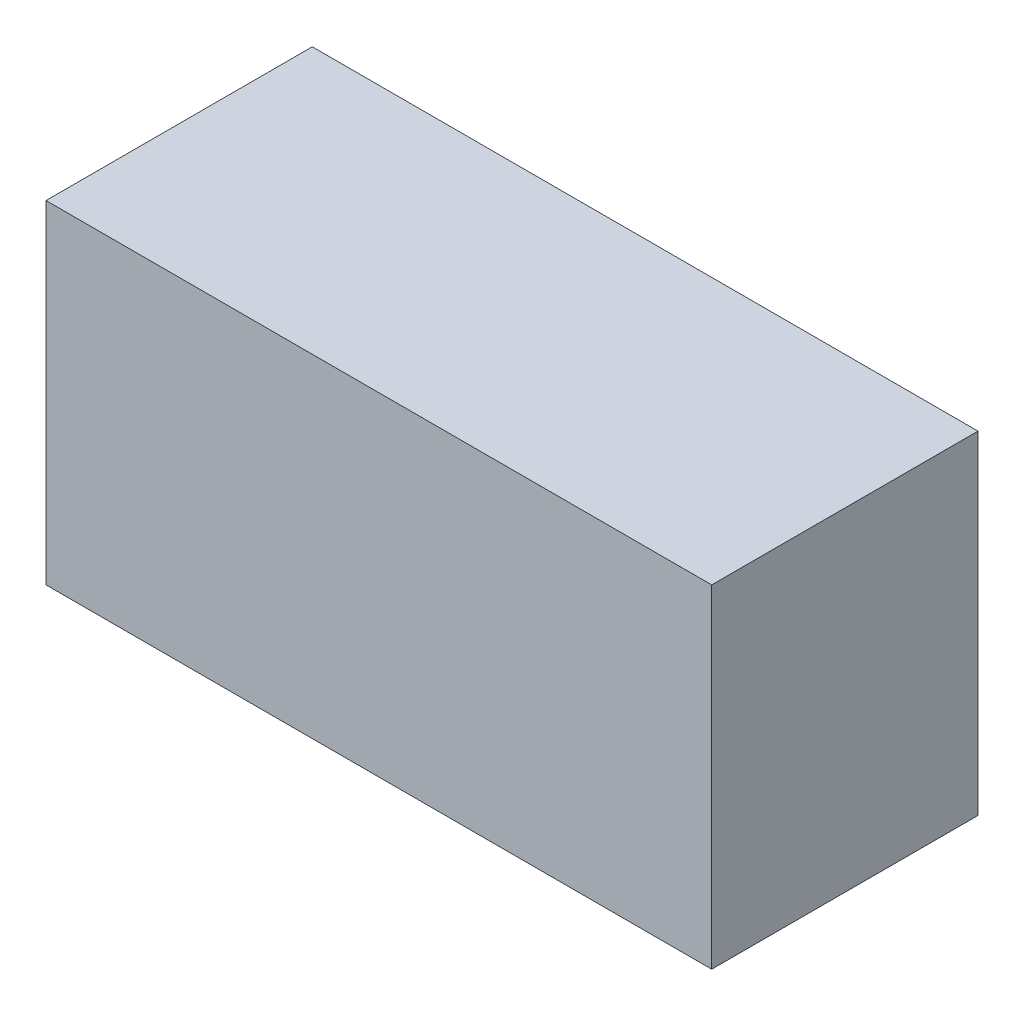
from build123d import *

# Parameters (mm, degrees)
SKETCH1_W           = 25.4
SKETCH1_H           = 12.7
BOSS_EXTRUDE1_DEPTH = 10.16
BOSS_EXTRUDE2_DEPTH = 1.27


with BuildPart() as part:
    # Sketch1 → Boss-Extrude1 (new body)
    with BuildSketch(Plane.XY):
        with Locations((12.7, -6.35)):
            Rectangle(SKETCH1_W, SKETCH1_H)
    extrude(amount=BOSS_EXTRUDE1_DEPTH)

    # Sketch2 → Boss-Extrude2 (add)
    with BuildSketch(Plane.ZY):
        Polygon((5.08, -2.756658991), (8.191924598, -4.553329495), (8.191924598, -8.146670505), (5.08, -9.943341009), (1.968075402, -8.146670505), (1.968075402, -4.553329495), align=None)
        Polygon((7.429924598, -4.993270401), (7.429924598, -7.706729599), (5.08, -9.063459199), (2.730075402, -7.706729599), (2.730075402, -4.993270401), (5.08, -3.636540801), align=None, mode=Mode.SUBTRACT)
    extrude(amount=BOSS_EXTRUDE2_DEPTH)


solid = part.part
